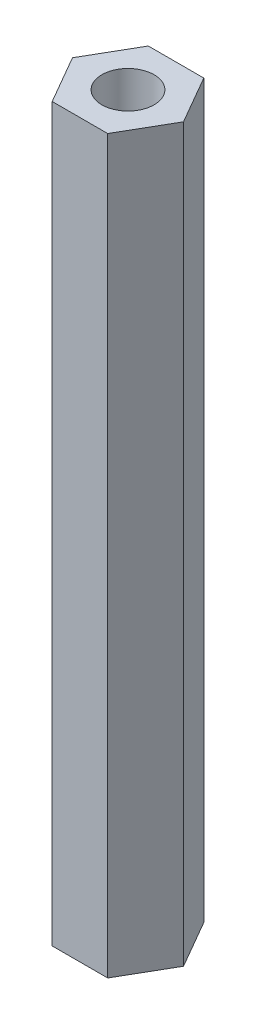
from build123d import *

# Parameters (mm, degrees)
EXTRUDE_1_DEPTH = 17.5
SKETCH_3_W      = 1.25
SKETCH_3_H      = 35.001


with BuildPart() as part:
    # 草图1 → 凸台-拉伸1 (new, symmetric)
    with BuildSketch(Plane(origin=(0, 0, 0), x_dir=(1, 0, 0), z_dir=(0, 1, 0))):
        Polygon((1.327905619, -2.3), (2.655811238, 0), (1.327905619, 2.3), (-1.327905619, 2.3), (-2.655811238, 0), (-1.327905619, -2.3), align=None)
    extrude(amount=EXTRUDE_1_DEPTH, both=True)

    # 草图3 → M3 螺纹孔1 (revolve, cut)
    with BuildSketch(Plane(origin=(0, 17.5, 0), x_dir=(0, 0, 1), z_dir=(1, 0, 0))):
        with Locations((0.625, 17.5005)):
            Rectangle(SKETCH_3_W, SKETCH_3_H)
    revolve(axis=Axis((0, 23.85, 0), (0, -1, 0)), mode=Mode.SUBTRACT)


solid = part.part
